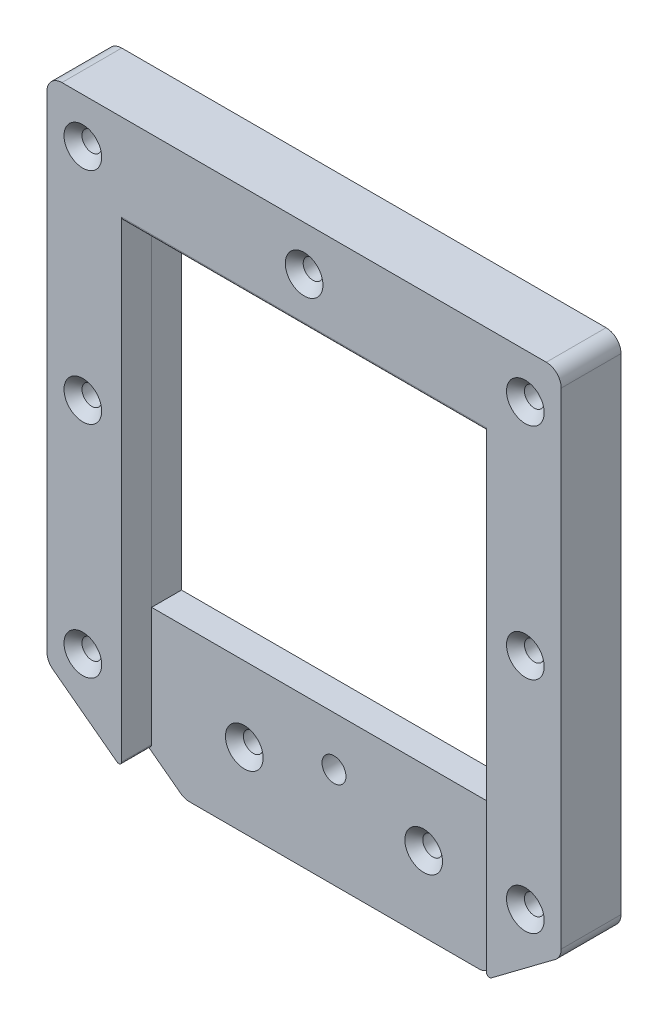
from build123d import *

# Parameters (mm, degrees)
BOSS_EXTRUDE1_DEPTH                                 = 10
BOSS_EXTRUDE2_DEPTH                                 = 10
FILLET1_R                                           = 1
FILLET2_R                                           = 4.999999999999999
FILLET3_R                                           = 1
SKETCH4_R                                           = 3.0000000000000018
SKETCH4_R_2                                         = 3.0000000000000027
SKETCH4_R_3                                         = 2.9999999999999862
SKETCH4_R_4                                         = 3.0000000000000266
SKETCH4_R_5                                         = 2.9999999999999947
SKETCH4_R_6                                         = 3.0000000000000044
SKETCH4_R_7                                         = 3.999999999999999
CUT_EXTRUDE1_DEPTH                                  = 20
CSK_FOR_M6_COUNTERSUNK_FLAT_HEAD_SCREW1_D           = 6.6
CSK_FOR_M6_COUNTERSUNK_FLAT_HEAD_SCREW1_CSINK_D     = 12.6
CSK_FOR_M6_COUNTERSUNK_FLAT_HEAD_SCREW1_CSINK_ANGLE = 90
CSK_FOR_M6_COUNTERSUNK_FLAT_HEAD_SCR_2_D            = 6.6
CSK_FOR_M6_COUNTERSUNK_FLAT_HEAD_SCR_2_CSINK_D      = 12.6
CSK_FOR_M6_COUNTERSUNK_FLAT_HEAD_SCR_2_CSINK_ANGLE  = 90
CUT_EXTRUDE2_DEPTH                                  = 4


with BuildPart() as part:
    # Sketch1 → Boss-Extrude1 (new body)
    with BuildSketch(Plane.XY):
        Polygon((-64.18159055149353, 136.6499257706783), (-64.18159055149351, -33.350074229321706), (-28.18019077559496, -60.35007422932169), (71.81700967260791, -60.35007422932168), (107.81840944850644, -33.350074229321706), (107.81840944850646, 136.64992577067832), align=None)
        Polygon((82.81840944850644, 111.64992577067832), (82.81840944850646, -10.350074229321688), (-39.18159055149353, -10.350074229321688), (-39.181590551493535, 111.64992577067831), align=None, mode=Mode.SUBTRACT)
    extrude(amount=BOSS_EXTRUDE1_DEPTH)

    # Sketch2 → Boss-Extrude2 (add)
    with BuildSketch(Plane.XY.offset(10)):
        Polygon((-64.18159055149353, 136.6499257706783), (107.81840944850646, 136.6499257706783), (107.8184094485065, -33.350074229321685), (82.81253069213544, -52.103754103569464), (82.81253069213545, 106.64992577067831), (-39.17571179512253, 106.64992577067831), (-39.17571179512251, -52.103754103569464), (-64.18159055149351, -33.350074229321706), align=None)
    extrude(amount=BOSS_EXTRUDE2_DEPTH)

    # Fillet1
    fillet1_edges = [part.edges().sort_by_distance(p)[0] for p in [
        (21.818409448506458, 106.64992577067831, 10),
        (21.818409448506458, 106.64992577067831, 20),
    ]]
    fillet(fillet1_edges, radius=FILLET1_R)

    # Fillet2
    fillet2_edges = [part.edges().sort_by_distance(p)[0] for p in [
        (-28.18019077559496, -60.35007422932169, 5),
        (-64.18159055149351, -33.350074229321706, 10),
        (-64.18159055149353, 136.6499257706783, 10),
        (71.81700967260791, -60.35007422932168, 5),
        (107.81840944850647, -33.35007422932169, 10),
        (107.81840944850646, 136.6499257706783, 10),
    ]]
    fillet(fillet2_edges, radius=FILLET2_R)

    # Fillet3
    fillet3_edges = [part.edges().sort_by_distance(p)[0] for p in [
        (82.81253069213544, -52.103754103569464, 15),
        (-39.17571179512251, -52.103754103569464, 15),
    ]]
    fillet(fillet3_edges, radius=FILLET3_R)

    # Sketch4 → Cut-Extrude1 (cut)
    with BuildSketch(Plane.XY.offset(20)):
        with Locations((-52.18159055149353, 121.64992577067831)):
            Circle(SKETCH4_R)
        with Locations((-52.18159055149302, -25.350074229321695)):
            Circle(SKETCH4_R)
        with Locations((-52.181590551493514, 48.14992577067831)):
            Circle(SKETCH4_R)
        with Locations((-8.181590551493347, -35.350074229321685)):
            Circle(SKETCH4_R_2)
        with Locations((51.81840944850665, -35.35007422932168)):
            Circle(SKETCH4_R_3)
        with Locations((95.81840944850728, 48.149925770678834)):
            Circle(SKETCH4_R_4)
        with Locations((95.81840944850728, -25.350074229321194)):
            Circle(SKETCH4_R_5)
        with Locations((95.81840944850677, 121.64992577067882)):
            Circle(SKETCH4_R_6)
        with Locations((21.818409448506646, -26.850074229321688)):
            Circle(SKETCH4_R_7)
        with Locations((21.818409448506618, 121.64992577067856)):
            Circle(SKETCH4_R)
    extrude(amount=-CUT_EXTRUDE1_DEPTH, mode=Mode.SUBTRACT)

    # CSK for M6 Countersunk Flat Head Screw1 (through all)
    with Locations(Plane(origin=(-52.181590551, 121.649925771, 20), x_dir=(1, 0, 0), z_dir=(0, 0, 1))):
        with Locations((0, 0), (0, -73.5), (0, -147), (148, -147), (148, -73.5), (148, 0), (74, 0)):
            CounterSinkHole(CSK_FOR_M6_COUNTERSUNK_FLAT_HEAD_SCREW1_D / 2, CSK_FOR_M6_COUNTERSUNK_FLAT_HEAD_SCREW1_CSINK_D / 2, counter_sink_angle=CSK_FOR_M6_COUNTERSUNK_FLAT_HEAD_SCREW1_CSINK_ANGLE)

    # CSK for M6 Countersunk Flat Head Scr 2 (through all)
    with Locations(Plane(origin=(-8.181590551, -35.350074229, 10), x_dir=(1, 0, 0), z_dir=(0, 0, 1))):
        with Locations((0, 0), (60, 0)):
            CounterSinkHole(CSK_FOR_M6_COUNTERSUNK_FLAT_HEAD_SCR_2_D / 2, CSK_FOR_M6_COUNTERSUNK_FLAT_HEAD_SCR_2_CSINK_D / 2, counter_sink_angle=CSK_FOR_M6_COUNTERSUNK_FLAT_HEAD_SCR_2_CSINK_ANGLE)

    # Sketch6 → Cut-Extrude2 (cut)
    with BuildSketch(Plane(origin=(0, 0, 0), x_dir=(-1, 0, 0), z_dir=(0, 0, -1))):
        Polygon((-14.890206218231118, -26.850074229321667), (-18.354307833368882, -20.850074229321656), (-25.282511063644392, -20.850074229321656), (-28.74661267878215, -26.850074229321656), (-25.282511063644392, -32.850074229321656), (-18.354307833368868, -32.850074229321656), align=None)
    extrude(amount=-CUT_EXTRUDE2_DEPTH, mode=Mode.SUBTRACT)


solid = part.part
